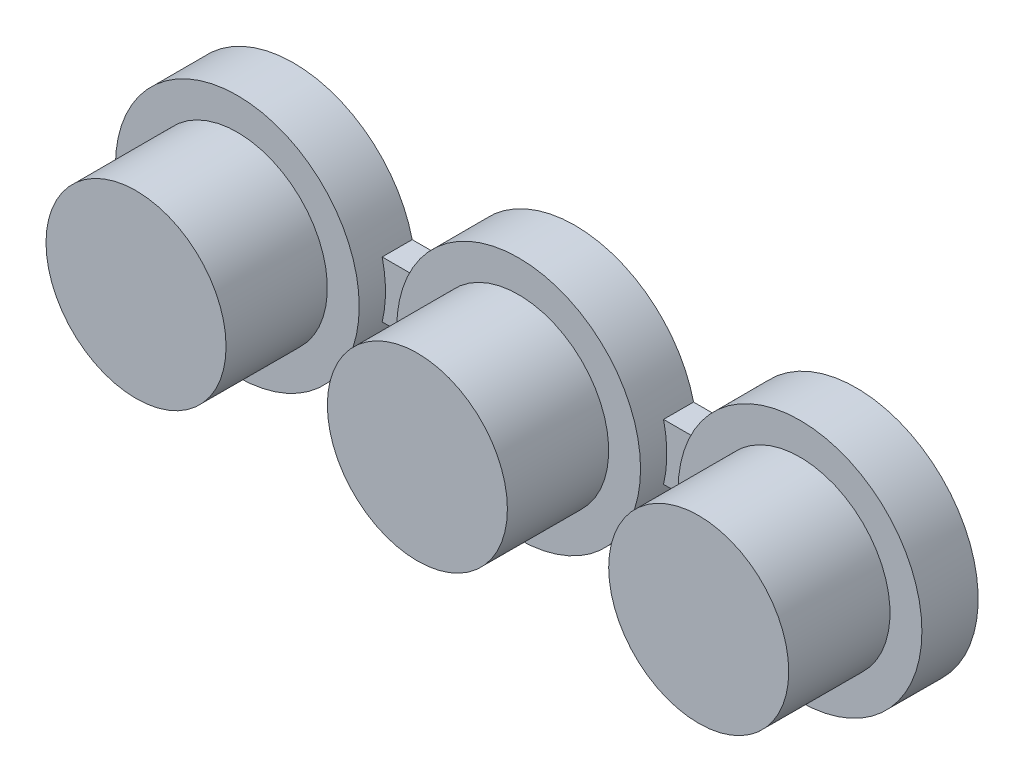
from build123d import *

# Parameters (mm, degrees)
SKETCH1_R             = 2.4
BOSS_EXTRUDE1_DEPTH   = 4.2
BOSS_EXTRUDE1_2_DEPTH = 4.2
BOSS_EXTRUDE1_3_DEPTH = 4.2
SKETCH2_W             = 14.663185534
SKETCH2_H             = 1.5
BOSS_EXTRUDE2_DEPTH   = 0.8
SKETCH3_R             = 3.25
BOSS_EXTRUDE3_DEPTH   = 1.5


with BuildPart() as part:
    # Sketch1 → Boss-Extrude1 (new body)
    with BuildSketch(Plane.XY):
        with Locations((-7.5, 0)):
            Circle(SKETCH1_R)
    extrude(amount=BOSS_EXTRUDE1_DEPTH)



with BuildPart() as body_2:
    # Sketch1 → Boss-Extrude1 2 (new body)
    with BuildSketch(Plane.XY):
        Circle(SKETCH1_R)
    extrude(amount=BOSS_EXTRUDE1_2_DEPTH)


with BuildPart() as body_3:
    # Sketch1 → Boss-Extrude1 3 (new body)
    with BuildSketch(Plane.XY):
        with Locations((7.5, 0)):
            Circle(SKETCH1_R)
    extrude(amount=BOSS_EXTRUDE1_3_DEPTH)


with BuildPart() as part_1:
    add(part.part)

    add(body_2.part)  # Boss-Extrude2 merges body 2

    add(body_3.part)  # Boss-Extrude2 merges body 3
    # Sketch2 → Boss-Extrude2 (add)
    with BuildSketch(Plane(origin=(0, 0, 0), x_dir=(-1, 0, 0), z_dir=(0, 0, -1))):
        Rectangle(SKETCH2_W, SKETCH2_H)
    extrude(amount=-BOSS_EXTRUDE2_DEPTH)

    # Sketch3 → Boss-Extrude3 (add)
    with BuildSketch(Plane(origin=(0, 0, 0), x_dir=(-1, 0, 0), z_dir=(0, 0, -1))):
        Circle(SKETCH3_R)
        with Locations((7.5, 0)):
            Circle(SKETCH3_R)
        with Locations((-7.5, 0)):
            Circle(SKETCH3_R)
    extrude(amount=-BOSS_EXTRUDE3_DEPTH)


solid = part_1.part
